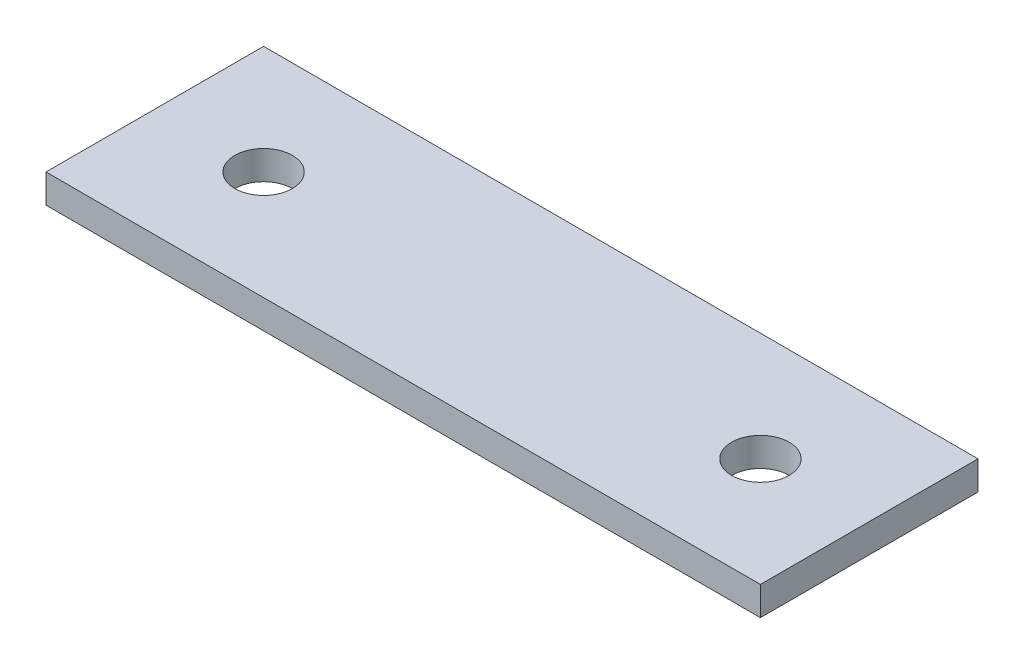
from build123d import *

# Parameters (mm, degrees)
SKETCH1_W           = 39.4
SKETCH1_H           = 12
SKETCH1_R           = 1.5875
BOSS_EXTRUDE1_DEPTH = 0.79375


with BuildPart() as part:
    # Sketch1 → Boss-Extrude1 (new, symmetric)
    with BuildSketch(Plane(origin=(0, 0, 0), x_dir=(1, 0, 0), z_dir=(0, 1, 0))):
        Rectangle(SKETCH1_W, SKETCH1_H)
        with Locations(Location((-13.7, 0, 0), (0, 0, 270))):
            Circle(SKETCH1_R, mode=Mode.SUBTRACT)
        with Locations(Location((13.7, 0, 0), (0, 0, 270))):
            Circle(SKETCH1_R, mode=Mode.SUBTRACT)
    extrude(amount=BOSS_EXTRUDE1_DEPTH, both=True)


solid = part.part
